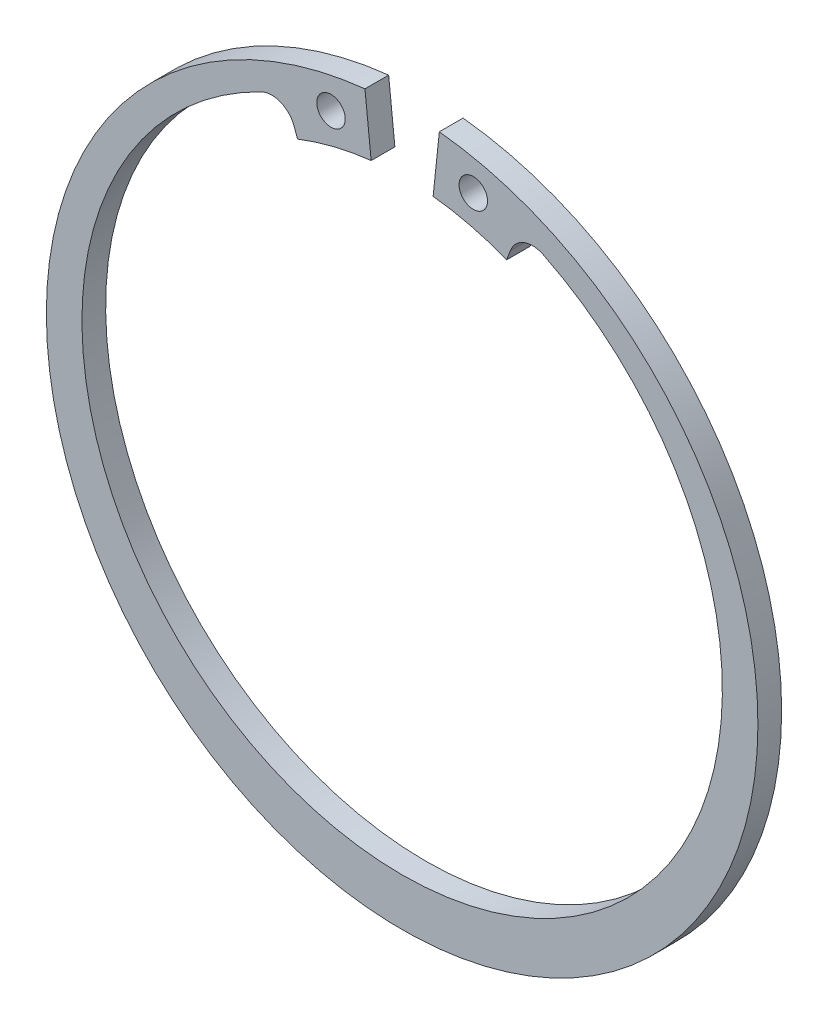
from build123d import *

# Parameters (mm, degrees)
ESQUISSE1_R          = 0.6
BASE_EXTRUSION_DEPTH = 1


with BuildPart() as part:
    # Esquisse1 → Base-Extrusion (new body)
    with BuildSketch(Plane.XY):
        with BuildLine():
            Line((-4.406978672, 11.661475663), (-4.564568548, 12.078480291))
            ThreePointArc((-4.564568548, 12.078480291), (-5.131923481, 12.654767663), (-5.94, 12.622969933))
            ThreePointArc((-5.94, 12.622969933), (0, -13), (5.94, 12.622969933))
            ThreePointArc((5.94, 12.622969933), (5.131923481, 12.654767663), (4.564568548, 12.078480291))
            Line((4.564568548, 12.078480291), (4.406978672, 11.661475663))
            ThreePointArc((4.406978672, 11.661475663), (2.882284348, 12.148709668), (1.306307585, 12.428686453))
            Line((1.306307585, 12.428686453), (1.567926949, 14.917828431))
            ThreePointArc((1.567926949, 14.917828431), (0, -15), (-1.567926949, 14.917828431))
            Line((-1.567926949, 14.917828431), (-1.306307585, 12.428686453))
            ThreePointArc((-1.306307585, 12.428686453), (-2.882284348, 12.148709668), (-4.406978672, 11.661475663))
        make_face()
        with Locations((-3, 13.4)):
            Circle(ESQUISSE1_R, mode=Mode.SUBTRACT)
        with Locations((3, 13.4)):
            Circle(ESQUISSE1_R, mode=Mode.SUBTRACT)
    extrude(amount=BASE_EXTRUSION_DEPTH)


solid = part.part
